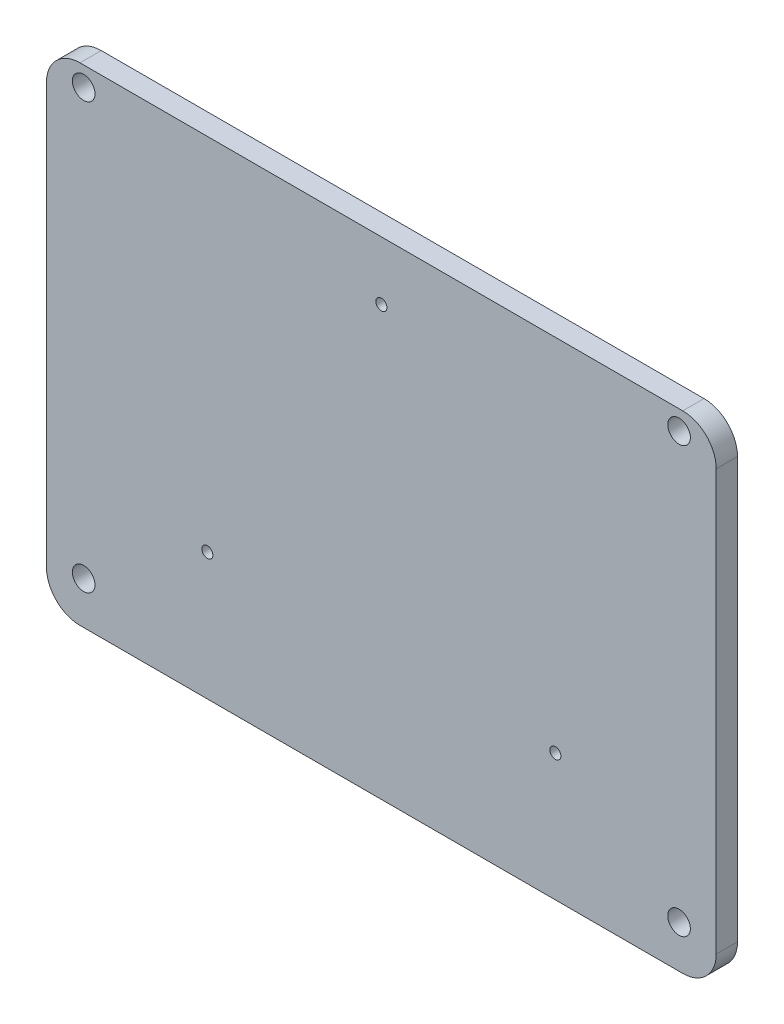
from build123d import *

# Parameters (mm, degrees)
SKETCH1_W               = 200
SKETCH1_H               = 155
SKETCH1_R               = 3.38
BOSS_EXTRUDE1_DEPTH     = 6.35
M4X0_7_TAPPED_HOLE1_D   = 3.3
CUT_EXTRUDE1_DEPTH      = 127.675066607
CUT_EXTRUDE1_DEPTH_BACK = 127.675066607
SKETCH4_W               = 200
SKETCH4_H               = 9.5
FILLET1_R               = 10


with BuildPart() as part:
    # Sketch1 → Boss-Extrude1 (new body)
    with BuildSketch(Plane.XY):
        Rectangle(SKETCH1_W, SKETCH1_H)
        with Locations((-88.9, 71.7)):
            Circle(SKETCH1_R, mode=Mode.SUBTRACT)
        with Locations((88.9, 71.7)):
            Circle(SKETCH1_R, mode=Mode.SUBTRACT)
        with Locations((88.9, -55.3)):
            Circle(SKETCH1_R, mode=Mode.SUBTRACT)
        with Locations((-88.9, -55.3)):
            Circle(SKETCH1_R, mode=Mode.SUBTRACT)
    extrude(amount=BOSS_EXTRUDE1_DEPTH)

    # M4x0.7 Tapped Hole1 (through all)
    with Locations(Plane(origin=(51.961524227, -30, 0), x_dir=(-1, 0, 0), z_dir=(0, 0, -1))):
        with Locations((0, 0), (103.923048454, 0), (51.961524227, 90)):
            Hole(M4X0_7_TAPPED_HOLE1_D / 2)

    # Sketch4 → Cut-Extrude1 (cut, two sides: drawn at the far end of the back side and taken through both)
    with BuildSketch(Plane.XY.offset(6.35).offset(-CUT_EXTRUDE1_DEPTH_BACK)):
        with Locations((0, -72.75)):
            Rectangle(SKETCH4_W, SKETCH4_H)
    extrude(amount=CUT_EXTRUDE1_DEPTH + CUT_EXTRUDE1_DEPTH_BACK, mode=Mode.SUBTRACT)

    # Fillet1
    fillet1_edges = [part.edges().sort_by_distance(p)[0] for p in [
        (-100, -68, 3.175),
        (100, -68, 3.175),
        (-100, 77.5, 3.175),
        (100, 77.5, 3.175),
    ]]
    fillet(fillet1_edges, radius=FILLET1_R)


solid = part.part
